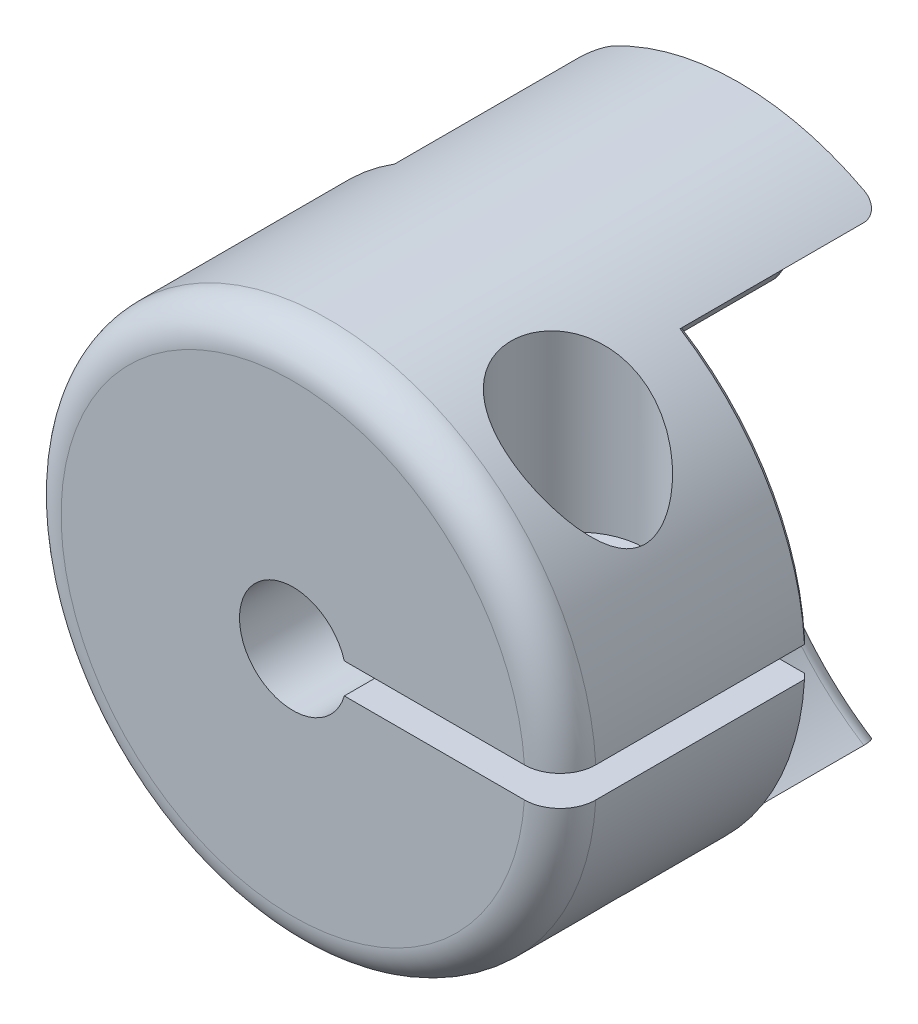
from build123d import *

# Parameters (mm, degrees)
SKETCH1_R               = 15
SKETCH1_R_2             = 3
BOSS_EXTRUDE1_DEPTH     = 12.5
SKETCH2_R               = 15
CUT_EXTRUDE1_DEPTH      = 11
CUT_EXTRUDE2_DEPTH      = 12
CUT_EXTRUDE3_DEPTH      = 1.7
CUT_EXTRUDE4_DEPTH      = 25.622144504
CUT_EXTRUDE4_DEPTH_BACK = 25.622144504
SKETCH7_R               = 2
CUT_EXTRUDE5_START      = 4.85
SKETCH8_R               = 3.75
CUT_EXTRUDE5_DEPTH      = 21.299006117
FILLET1_R               = 2
FILLET2_R               = 1
CHAMFER1_SIZE           = 0.3


with BuildPart() as part:
    # Sketch1 → Boss-Extrude1 (new, symmetric)
    with BuildSketch(Plane.XY):
        Circle(SKETCH1_R)
        Circle(SKETCH1_R_2, mode=Mode.SUBTRACT)
    extrude(amount=BOSS_EXTRUDE1_DEPTH, both=True)

    # Sketch2 → Cut-Extrude1 (cut)
    with BuildSketch(Plane(origin=(0, 0, -12.5), x_dir=(-1, 0, 0), z_dir=(0, 0, -1))):
        with Locations((-16, 0)):
            Circle(SKETCH2_R)
        with Locations((16, 0)):
            Circle(SKETCH2_R)
    extrude(amount=-CUT_EXTRUDE1_DEPTH, mode=Mode.SUBTRACT)

    # Sketch3 → Cut-Extrude2 (cut)
    with BuildSketch(Plane(origin=(0, 0, -12.5), x_dir=(-1, 0, 0), z_dir=(0, 0, -1))):
        with BuildLine():
            Line((7.954715583, -0.85), (11, -0.85))
            Line((11, -0.85), (11, 0.85))
            Line((11, 0.85), (7.954715583, 0.85))
            ThreePointArc((7.954715583, 0.85), (-8, 0), (7.954715583, -0.85))
        make_face()
    extrude(amount=-CUT_EXTRUDE2_DEPTH, mode=Mode.SUBTRACT)

    # Sketch6 → Cut-Extrude3 (cut)
    with BuildSketch(Plane(origin=(0, -0.85, 0), x_dir=(1, 0, 0), z_dir=(0, 1, 0))):
        Polygon((-11, 0.5), (15, -25.5), (15, 0.5), (15, 1.5), (-11, 1.5), align=None)
    extrude(amount=CUT_EXTRUDE3_DEPTH, mode=Mode.SUBTRACT)

    # Sketch7 → Cut-Extrude4 (cut, two sides: drawn at the far end of the back side and taken through both)
    with BuildSketch(Plane(origin=(0, 0, 0), x_dir=(1, 0, 0), z_dir=(0, 1, 0)).offset(-CUT_EXTRUDE4_DEPTH_BACK)):
        with Locations(Location((8.975897302, -5.5, 0), (0, 0, 270))):
            Circle(SKETCH7_R)
    extrude(amount=CUT_EXTRUDE4_DEPTH + CUT_EXTRUDE4_DEPTH_BACK, mode=Mode.SUBTRACT)

    # Sketch8 → Cut-Extrude5 (cut, through all)
    with BuildSketch(Plane(origin=(0, -0.85, 0), x_dir=(1, 0, 0), z_dir=(0, 1, 0)).offset(CUT_EXTRUDE5_START)):
        with Locations((8.975897302, -5.5)):
            Circle(SKETCH8_R)
    extrude(amount=CUT_EXTRUDE5_DEPTH, mode=Mode.SUBTRACT)

    # Fillet1
    fillet1_edges = [part.edges().sort_by_distance(p)[0] for p in [
        (-15, 0, 12.5),
    ]]
    fillet(fillet1_edges, radius=FILLET1_R)

    # Fillet2
    fillet2_edges = [part.edges().sort_by_distance(p)[0] for p in [
        (5.160499055, -10.368472369, -12.5),
        (-5.160499055, 10.368472369, -12.5),
        (-5.160499055, -10.368472369, -12.5),
        (5.160499055, 10.368472369, -12.5),
        (0, 8, -12.5),
        (0, -8, -12.5),
    ]]
    fillet(fillet2_edges, radius=FILLET2_R)

    # Chamfer1
    chamfer1_edges = [part.edges().sort_by_distance(p)[0] for p in [
        (12.923271403, 7.615054579, -1.5),
        (-15, 0, -1.5),
        (12.923271403, -7.615054579, -1.5),
    ]]
    chamfer(chamfer1_edges, length=CHAMFER1_SIZE)


solid = part.part
